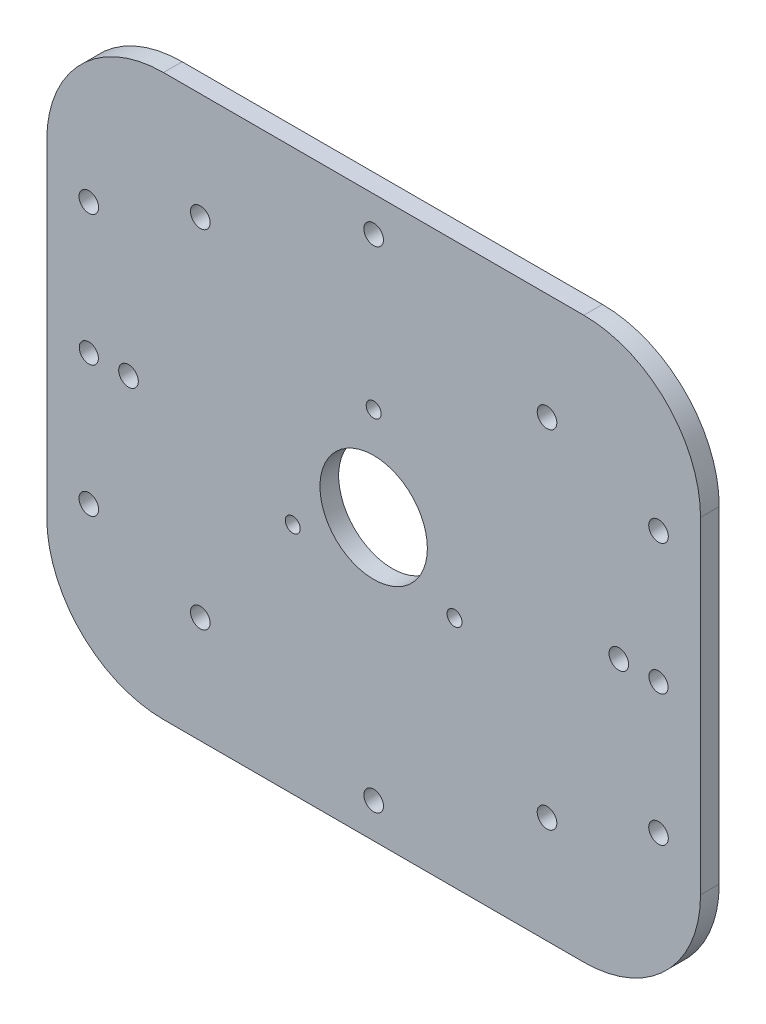
from build123d import *

# Parameters (mm, degrees)
SKETCH_1_W                 = 140
SKETCH_1_H                 = 120
SKETCH_1_R                 = 11.5
EXTRUDE_1_DEPTH            = 4
SKETCH_31_R                = 2.05
SKETCH_31_R_2              = 2.1
CUT_EXTRUDE_16_DEPTH       = 10
MIRROR_2_COPY_1_SKETCH_R   = 2.05
MIRROR_2_COPY_1_SKETCH_R_2 = 2.1
MIRROR_2_COPY_1_DEPTH      = 10
FILLET_8_R                 = 25
SKETCH_32_R                = 2.1
CUT_EXTRUDE_17_DEPTH       = 10
SKETCH_33_R                = 1.6
CUT_EXTRUDE_18_DEPTH       = 10


with BuildPart() as part:
    # 草图1 → 凸台-拉伸1 (new body)
    with BuildSketch(Plane.XY):
        with Locations((70, 60)):
            Rectangle(SKETCH_1_W, SKETCH_1_H)
        with Locations((70, 60)):
            Circle(SKETCH_1_R, mode=Mode.SUBTRACT)
    extrude(amount=EXTRUDE_1_DEPTH)

    # 草图31 → 切除-拉伸16 (cut)
    with BuildSketch(Plane.XY.offset(4)):
        with Locations((9, 60)):
            Circle(SKETCH_31_R)
        with Locations((9, 88)):
            Circle(SKETCH_31_R_2)
    cut_extrude_16 = extrude(amount=-CUT_EXTRUDE_16_DEPTH, mode=Mode.SUBTRACT)

    # 镜向1: 切除-拉伸16 across plane
    add(cut_extrude_16.mirror(Plane.ZX.offset(60)), mode=Mode.SUBTRACT)

    # 镜向2: 切除-拉伸16 across plane
    add(cut_extrude_16.mirror(Plane.ZY.offset(-70)), mode=Mode.SUBTRACT)

    # 镜向2 copy 1 sketch → 镜向2 copy 1 (cut)
    with BuildSketch(Plane(origin=(140, 120, 4), x_dir=(-1, 0, 0), z_dir=(0, 0, 1))):
        with Locations((9, 60)):
            Circle(MIRROR_2_COPY_1_SKETCH_R)
        with Locations((9, 88)):
            Circle(MIRROR_2_COPY_1_SKETCH_R_2)
    extrude(amount=-MIRROR_2_COPY_1_DEPTH, mode=Mode.SUBTRACT)

    # 圆角8
    fillet_8_edges = [part.edges().sort_by_distance(p)[0] for p in [
        (0, 120, 2),
        (140, 120, 2),
        (140, 0, 2),
        (0, 0, 2),
    ]]
    fillet(fillet_8_edges, radius=FILLET_8_R)

    # 草图32 → 切除-拉伸17 (cut)
    with BuildSketch(Plane.XY.offset(4)):
        with Locations((70, 112.5)):
            Circle(SKETCH_32_R)
        with Locations((107.123106012, 97.123106012)):
            Circle(SKETCH_32_R)
        with Locations((122.5, 60)):
            Circle(SKETCH_32_R)
        with Locations((107.123106012, 22.876893988)):
            Circle(SKETCH_32_R)
        with Locations((70, 7.5)):
            Circle(SKETCH_32_R)
        with Locations((32.876893988, 22.876893988)):
            Circle(SKETCH_32_R)
        with Locations((17.5, 60)):
            Circle(SKETCH_32_R)
        with Locations((32.876893988, 97.123106012)):
            Circle(SKETCH_32_R)
    extrude(amount=-CUT_EXTRUDE_17_DEPTH, mode=Mode.SUBTRACT)

    # 草图33 → 切除-拉伸18 (cut)
    with BuildSketch(Plane.XY.offset(4)):
        with Locations((70, 80)):
            Circle(SKETCH_33_R)
        with Locations((87.320508076, 50)):
            Circle(SKETCH_33_R)
        with Locations((52.679491924, 50)):
            Circle(SKETCH_33_R)
    extrude(amount=-CUT_EXTRUDE_18_DEPTH, mode=Mode.SUBTRACT)


solid = part.part
